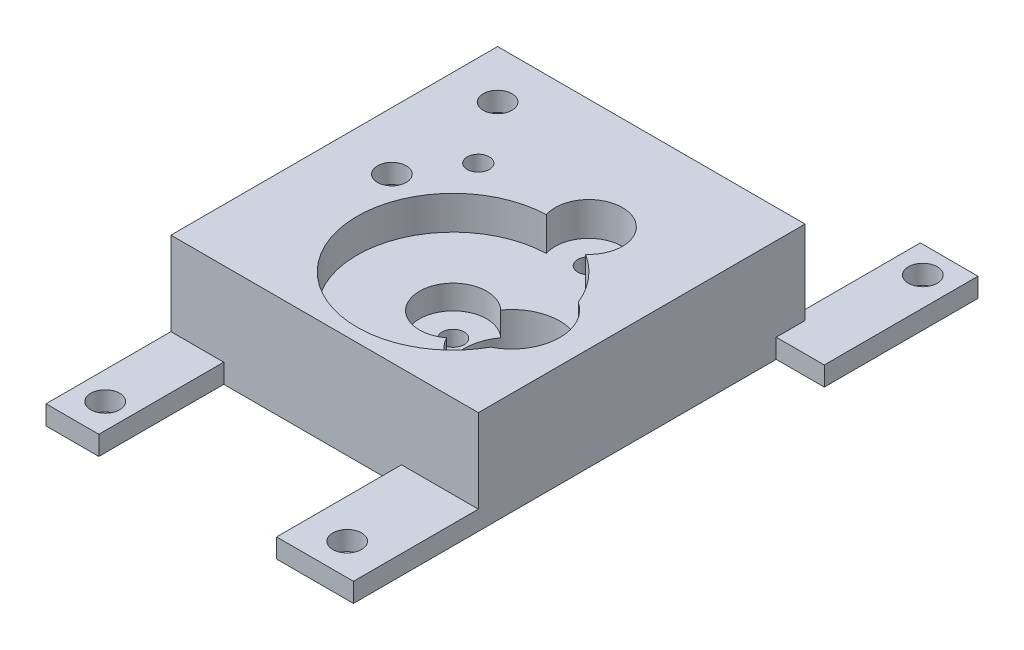
from build123d import *

# Parameters (mm, degrees)
SKETCH_1_W          = 32
SKETCH_1_H          = 34
EXTRUDE_1_DEPTH     = 3.5
EXTRUDE_START       = -2.5
SKETCH_1_30_W       = 32
SKETCH_1_30_H       = 34
EXTRUDE_2_DEPTH     = 2.5
EXTRUDE_START_2     = -4.5
SKETCH_1_31_W       = 32
SKETCH_1_31_H       = 34
SKETCH_1_31_R       = 5
EXTRUDE_3_DEPTH     = 2
SKETCH_1_32_W       = 32
SKETCH_1_32_H       = 34
SKETCH_1_32_R       = 3.1
EXTRUDE_4_DEPTH     = 2.7
SKETCH_2_R          = 1.5
CUT_EXTRUDE_1_DEPTH = 32.693690224
SKETCH_2_3_R        = 2.25
CUT_EXTRUDE_2_DEPTH = 8.7
SKETCH_1_33_R       = 1.15
CUT_EXTRUDE_3_DEPTH = 4
SKETCH_3_W          = 5.5
SKETCH_3_H          = 13
SKETCH_3_R          = 1.5
SKETCH_3_W_2        = 8
SKETCH_3_W_3        = 5
SKETCH_3_H_2        = 3
EXTRUDE_5_DEPTH     = 2
SKETCH_1_34_R       = 1.15
CUT_EXTRUDE_4_DEPTH = 5.2
CUT_EXTRUDE_START   = 3.5
SKETCH_1_37_R       = 1.15
CUT_EXTRUDE_6_DEPTH = 2


with BuildPart() as part:
    # 草图1 → 凸台-拉伸1 (new body)
    with BuildSketch(Plane(origin=(0, 0, 0), x_dir=(1, 0, 0), z_dir=(0, 1, 0))):
        with Locations((3, 6)):
            Rectangle(SKETCH_1_W, SKETCH_1_H)
        with BuildLine():
            ThreePointArc((13.731280316, -4.4612147), (-3.554893366, -4.816108921), (4.687954327, 10.382351934))
            ThreePointArc((4.687954327, 10.382351934), (8.931780662, 14.858222386), (10.315634647, 8.847529713))
            ThreePointArc((10.315634647, 8.847529713), (12.64747139, 6.812247403), (14.245257691, 4.161414399))
            ThreePointArc((14.245257691, 4.161414399), (16.464642722, -0.297511749), (13.731280316, -4.4612147))
        make_face(mode=Mode.SUBTRACT)
    extrude(amount=EXTRUDE_1_DEPTH)

    # 草图1<30> → 凸台-拉伸2 (add)
    with BuildSketch(Plane(origin=(0, 0, 0), x_dir=(1, 0, 0), z_dir=(0, 1, 0)).offset(EXTRUDE_START)):
        with Locations((3, 6)):
            Rectangle(SKETCH_1_30_W, SKETCH_1_30_H)
        with BuildLine():
            ThreePointArc((7.408784414, 2.911712865), (16.464642722, -0.297511749), (7.091673359, -2.408231444))
            ThreePointArc((7.091673359, -2.408231444), (1.49122024, 0.595023498), (7.408784414, 2.911712865))
        make_face(mode=Mode.SUBTRACT)
    extrude(amount=EXTRUDE_2_DEPTH)

    # 草图1<31> → 凸台-拉伸3 (add)
    with BuildSketch(Plane(origin=(0, 0, 0), x_dir=(1, 0, 0), z_dir=(0, 1, 0)).offset(EXTRUDE_START_2)):
        with Locations((3, 6)):
            Rectangle(SKETCH_1_31_W, SKETCH_1_31_H)
        with Locations(Location((11.473501894, 0, 0), (0, 0, 56.333964125))):
            Circle(SKETCH_1_31_R, mode=Mode.SUBTRACT)
    extrude(amount=EXTRUDE_3_DEPTH)

    # 草图1<32> → 凸台-拉伸4 (add)
    with BuildSketch(Plane(origin=(0, 0, 0), x_dir=(1, 0, 0), z_dir=(0, 1, 0)).offset(EXTRUDE_START_2)):
        with Locations((3, 6)):
            Rectangle(SKETCH_1_32_W, SKETCH_1_32_H)
        with Locations(Location((11.473501894, 0, 0), (0, 0, 270))):
            Circle(SKETCH_1_32_R, mode=Mode.SUBTRACT)
    extrude(amount=-EXTRUDE_4_DEPTH)

    # 草图2 → 切除-拉伸1 (cut, through all)
    with BuildSketch(Plane.XZ.offset(7.2)):
        with Locations(Location((-8, -18, 0), (0, 0, 270))):
            Circle(SKETCH_2_R)
        with Locations(Location((-7, -6, 0), (0, 0, 270))):
            Circle(SKETCH_2_R)
    extrude(amount=-CUT_EXTRUDE_1_DEPTH, mode=Mode.SUBTRACT)

    # 草图2<3> → 切除-拉伸2 (cut)
    with BuildSketch(Plane.XZ.offset(7.2)):
        with Locations(Location((-8, -18, 0), (0, 0, 270))):
            Circle(SKETCH_2_3_R)
        with Locations(Location((-7, -6, 0), (0, 0, 270))):
            Circle(SKETCH_2_3_R)
    extrude(amount=-CUT_EXTRUDE_2_DEPTH, mode=Mode.SUBTRACT)

    # 草图1<33> → 切除-拉伸3 (cut)
    with BuildSketch(Plane(origin=(0, 0, 0), x_dir=(1, 0, 0), z_dir=(0, 1, 0))):
        with Locations(Location((-3.489130435, 11.48154906, 0), (0, 0, 270))):
            Circle(SKETCH_1_33_R)
        with Locations(Location((8.010869565, 11.48154906, 0), (0, 0, 270))):
            Circle(SKETCH_1_33_R)
    extrude(amount=-CUT_EXTRUDE_3_DEPTH, mode=Mode.SUBTRACT)

    # 草图3 → 凸台-拉伸5 (add)
    # profile 1 of 4: a face of its own
    with BuildSketch(Plane.XZ.offset(7.2)):
        with Locations((-10.25, 17.5)):
            Rectangle(SKETCH_3_W, SKETCH_3_H)
        with Locations(Location((-10.12152848, 20.714718626, 0), (0, 0, 270))):
            Circle(SKETCH_3_R, mode=Mode.SUBTRACT)
    # profile 2 of 4: a face of its own
    with BuildSketch(Plane.XZ.offset(7.2)):
        with Locations((15, 17.5)):
            Rectangle(SKETCH_3_W_2, SKETCH_3_H)
        with Locations(Location((15.05833067, 20.714718626, 0), (0, 0, 270))):
            Circle(SKETCH_3_R, mode=Mode.SUBTRACT)
    # profile 3 of 4: a face of its own
    with BuildSketch(Plane.XZ.offset(7.2)):
        Polygon((19, -23), (18, -23), (18, -36), (24, -36), (24, -23), align=None)
        with Locations(Location((21.021229109, -33.234018716, 0), (0, 0, 270))):
            Circle(SKETCH_3_R, mode=Mode.SUBTRACT)
    # profile 4 of 4: a face of its own
    with BuildSketch(Plane.XZ.offset(7.2)):
        with Locations((21.5, -21.5)):
            Rectangle(SKETCH_3_W_3, SKETCH_3_H_2)
    extrude(amount=-EXTRUDE_5_DEPTH)

    # 草图1<34> → 切除-拉伸4 (cut)
    with BuildSketch(Plane(origin=(0, 0, 0), x_dir=(1, 0, 0), z_dir=(0, 1, 0))):
        with Locations(Location((4.985018819, 0.386765274, 0), (0, 0, 90))):
            Circle(SKETCH_1_34_R)
    extrude(amount=-CUT_EXTRUDE_4_DEPTH, mode=Mode.SUBTRACT)

    # 草图1<37> → 切除-拉伸6 (cut)
    with BuildSketch(Plane(origin=(0, 0, 0), x_dir=(1, 0, 0), z_dir=(0, 1, 0)).offset(CUT_EXTRUDE_START)):
        with Locations(Location((-3.489130435, 11.48154906, 0), (0, 0, 90))):
            Circle(SKETCH_1_37_R)
    extrude(amount=-CUT_EXTRUDE_6_DEPTH, mode=Mode.SUBTRACT)


solid = part.part
